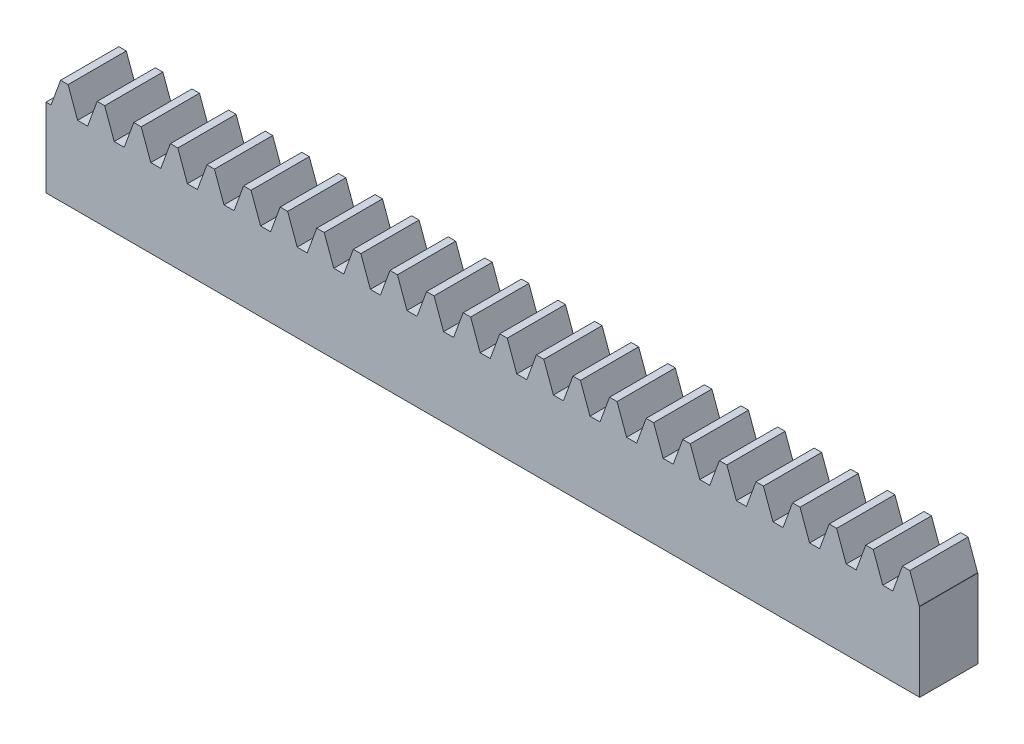
from build123d import *

# Parameters (mm, degrees)
BLANKSKE_W                      = 150
BLANKSKE_H                      = 12
BLANK_DEPTH                     = 5
TOOTHCUTSIM_DEPTH               = 151.562279473
TEETHCUTS_COUNT                 = 25
TEETHCUTS_PITCH                 = 6.2831853
SKETCH1_W                       = 150
SKETCH1_H                       = 6
BOSS_EXTRUDE1_DEPTH             = 10
MIRROR1_COPY_1_DEPTH            = 151.562279473
MIRROR1_COPY_2_DEPTH            = 151.562279473
MIRROR1_COPY_3_DEPTH            = 151.562279473
MIRROR1_COPY_4_DEPTH            = 151.562279473
MIRROR1_COPY_5_DEPTH            = 151.562279473
MIRROR1_COPY_6_DEPTH            = 151.562279473
MIRROR1_COPY_7_DEPTH            = 151.562279473
MIRROR1_COPY_8_DEPTH            = 151.562279473
MIRROR1_COPY_9_DEPTH            = 151.562279473
MIRROR1_COPY_10_DEPTH           = 151.562279473
MIRROR1_COPY_11_DEPTH           = 151.562279473
MIRROR1_COPY_12_DEPTH           = 151.562279473
MIRROR1_COPY_13_DEPTH           = 151.562279473
MIRROR1_COPY_14_DEPTH           = 151.562279473
MIRROR1_COPY_15_DEPTH           = 151.562279473
MIRROR1_COPY_16_DEPTH           = 151.562279473
MIRROR1_COPY_17_DEPTH           = 151.562279473
MIRROR1_COPY_18_DEPTH           = 151.562279473
MIRROR1_COPY_19_DEPTH           = 151.562279473
MIRROR1_COPY_20_DEPTH           = 151.562279473
MIRROR1_COPY_21_DEPTH           = 151.562279473
MIRROR1_COPY_22_DEPTH           = 151.562279473
MIRROR1_COPY_23_DEPTH           = 151.562279473
MIRROR1_COPY_24_DEPTH           = 151.562279473
MIRROR1_COPY_25_DEPTH           = 151.562279473
F_4_0MM_DOWEL_HOLE1_D           = 4
F_4_0MM_DOWEL_HOLE1_DEPTH       = 3
F_4_0MM_DOWEL_HOLE1_CSINK_D     = 4.05
F_4_0MM_DOWEL_HOLE1_CSINK_ANGLE = 90
F_4_0MM_DOWEL_HOLE1_TIP         = 1.201721238
SKETCH7_W                       = 12
SKETCH7_H                       = 6
CUT_EXTRUDE1_DEPTH              = 9.2
FILLET2_R                       = 5
FILLET3_R                       = 5


with BuildPart() as part:
    # BlankSke → Blank (new body)
    with BuildSketch(Plane.XY):
        with Locations((75, 6)):
            Rectangle(BLANKSKE_W, BLANKSKE_H)
    blank = extrude(amount=-BLANK_DEPTH)

    # TooCutSkeSim → ToothCutSim (cut, through all)
    with BuildSketch(Plane.XY):
        Polygon((0.861870739, 7.5), (-0.861870739, 7.5), (-2.508981637, 12.0254), (2.508981637, 12.0254), align=None)
    toothcutsim = extrude(amount=-TOOTHCUTSIM_DEPTH, mode=Mode.SUBTRACT)

    # TeethCuts: ToothCutSim ×25
    with Locations(*[(i * TEETHCUTS_PITCH, 0, 0) for i in range(1, TEETHCUTS_COUNT)]):
        add(toothcutsim, mode=Mode.SUBTRACT)

    # Sketch1 → Boss-Extrude1 (add)
    with BuildSketch(Plane(origin=(0, 0, -5), x_dir=(-1, 0, 0), z_dir=(0, 0, -1))):
        with Locations((-75, -3)):
            Rectangle(SKETCH1_W, SKETCH1_H)
    extrude(amount=-BOSS_EXTRUDE1_DEPTH)

    # Mirror1: Blank across plane
    add(blank.mirror(Plane.XY))

    # Mirror1 copy 1 sketch → Mirror1 copy 1 (cut, through all)
    with BuildSketch(Plane(origin=(6.2831853, 0, 0), x_dir=(1, 0, 0), z_dir=(0, 0, -1))):
        Polygon((0.861870739, -7.5), (-0.861870739, -7.5), (-2.508981637, -12.0254), (2.508981637, -12.0254), align=None)
    extrude(amount=-MIRROR1_COPY_1_DEPTH, mode=Mode.SUBTRACT)

    # Mirror1 copy 2 sketch → Mirror1 copy 2 (cut, through all)
    with BuildSketch(Plane(origin=(12.5663706, 0, 0), x_dir=(1, 0, 0), z_dir=(0, 0, -1))):
        Polygon((0.861870739, -7.5), (-0.861870739, -7.5), (-2.508981637, -12.0254), (2.508981637, -12.0254), align=None)
    extrude(amount=-MIRROR1_COPY_2_DEPTH, mode=Mode.SUBTRACT)

    # Mirror1 copy 3 sketch → Mirror1 copy 3 (cut, through all)
    with BuildSketch(Plane(origin=(18.8495559, 0, 0), x_dir=(1, 0, 0), z_dir=(0, 0, -1))):
        Polygon((0.861870739, -7.5), (-0.861870739, -7.5), (-2.508981637, -12.0254), (2.508981637, -12.0254), align=None)
    extrude(amount=-MIRROR1_COPY_3_DEPTH, mode=Mode.SUBTRACT)

    # Mirror1 copy 4 sketch → Mirror1 copy 4 (cut, through all)
    with BuildSketch(Plane(origin=(25.1327412, 0, 0), x_dir=(1, 0, 0), z_dir=(0, 0, -1))):
        Polygon((0.861870739, -7.5), (-0.861870739, -7.5), (-2.508981637, -12.0254), (2.508981637, -12.0254), align=None)
    extrude(amount=-MIRROR1_COPY_4_DEPTH, mode=Mode.SUBTRACT)

    # Mirror1 copy 5 sketch → Mirror1 copy 5 (cut, through all)
    with BuildSketch(Plane(origin=(31.4159265, 0, 0), x_dir=(1, 0, 0), z_dir=(0, 0, -1))):
        Polygon((0.861870739, -7.5), (-0.861870739, -7.5), (-2.508981637, -12.0254), (2.508981637, -12.0254), align=None)
    extrude(amount=-MIRROR1_COPY_5_DEPTH, mode=Mode.SUBTRACT)

    # Mirror1 copy 6 sketch → Mirror1 copy 6 (cut, through all)
    with BuildSketch(Plane(origin=(37.6991118, 0, 0), x_dir=(1, 0, 0), z_dir=(0, 0, -1))):
        Polygon((0.861870739, -7.5), (-0.861870739, -7.5), (-2.508981637, -12.0254), (2.508981637, -12.0254), align=None)
    extrude(amount=-MIRROR1_COPY_6_DEPTH, mode=Mode.SUBTRACT)

    # Mirror1 copy 7 sketch → Mirror1 copy 7 (cut, through all)
    with BuildSketch(Plane(origin=(43.9822971, 0, 0), x_dir=(1, 0, 0), z_dir=(0, 0, -1))):
        Polygon((0.861870739, -7.5), (-0.861870739, -7.5), (-2.508981637, -12.0254), (2.508981637, -12.0254), align=None)
    extrude(amount=-MIRROR1_COPY_7_DEPTH, mode=Mode.SUBTRACT)

    # Mirror1 copy 8 sketch → Mirror1 copy 8 (cut, through all)
    with BuildSketch(Plane(origin=(50.2654824, 0, 0), x_dir=(1, 0, 0), z_dir=(0, 0, -1))):
        Polygon((0.861870739, -7.5), (-0.861870739, -7.5), (-2.508981637, -12.0254), (2.508981637, -12.0254), align=None)
    extrude(amount=-MIRROR1_COPY_8_DEPTH, mode=Mode.SUBTRACT)

    # Mirror1 copy 9 sketch → Mirror1 copy 9 (cut, through all)
    with BuildSketch(Plane(origin=(56.5486677, 0, 0), x_dir=(1, 0, 0), z_dir=(0, 0, -1))):
        Polygon((0.861870739, -7.5), (-0.861870739, -7.5), (-2.508981637, -12.0254), (2.508981637, -12.0254), align=None)
    extrude(amount=-MIRROR1_COPY_9_DEPTH, mode=Mode.SUBTRACT)

    # Mirror1 copy 10 sketch → Mirror1 copy 10 (cut, through all)
    with BuildSketch(Plane(origin=(62.831853, 0, 0), x_dir=(1, 0, 0), z_dir=(0, 0, -1))):
        Polygon((0.861870739, -7.5), (-0.861870739, -7.5), (-2.508981637, -12.0254), (2.508981637, -12.0254), align=None)
    extrude(amount=-MIRROR1_COPY_10_DEPTH, mode=Mode.SUBTRACT)

    # Mirror1 copy 11 sketch → Mirror1 copy 11 (cut, through all)
    with BuildSketch(Plane(origin=(69.1150383, 0, 0), x_dir=(1, 0, 0), z_dir=(0, 0, -1))):
        Polygon((0.861870739, -7.5), (-0.861870739, -7.5), (-2.508981637, -12.0254), (2.508981637, -12.0254), align=None)
    extrude(amount=-MIRROR1_COPY_11_DEPTH, mode=Mode.SUBTRACT)

    # Mirror1 copy 12 sketch → Mirror1 copy 12 (cut, through all)
    with BuildSketch(Plane(origin=(75.3982236, 0, 0), x_dir=(1, 0, 0), z_dir=(0, 0, -1))):
        Polygon((0.861870739, -7.5), (-0.861870739, -7.5), (-2.508981637, -12.0254), (2.508981637, -12.0254), align=None)
    extrude(amount=-MIRROR1_COPY_12_DEPTH, mode=Mode.SUBTRACT)

    # Mirror1 copy 13 sketch → Mirror1 copy 13 (cut, through all)
    with BuildSketch(Plane(origin=(81.6814089, 0, 0), x_dir=(1, 0, 0), z_dir=(0, 0, -1))):
        Polygon((0.861870739, -7.5), (-0.861870739, -7.5), (-2.508981637, -12.0254), (2.508981637, -12.0254), align=None)
    extrude(amount=-MIRROR1_COPY_13_DEPTH, mode=Mode.SUBTRACT)

    # Mirror1 copy 14 sketch → Mirror1 copy 14 (cut, through all)
    with BuildSketch(Plane(origin=(87.9645942, 0, 0), x_dir=(1, 0, 0), z_dir=(0, 0, -1))):
        Polygon((0.861870739, -7.5), (-0.861870739, -7.5), (-2.508981637, -12.0254), (2.508981637, -12.0254), align=None)
    extrude(amount=-MIRROR1_COPY_14_DEPTH, mode=Mode.SUBTRACT)

    # Mirror1 copy 15 sketch → Mirror1 copy 15 (cut, through all)
    with BuildSketch(Plane(origin=(94.2477795, 0, 0), x_dir=(1, 0, 0), z_dir=(0, 0, -1))):
        Polygon((0.861870739, -7.5), (-0.861870739, -7.5), (-2.508981637, -12.0254), (2.508981637, -12.0254), align=None)
    extrude(amount=-MIRROR1_COPY_15_DEPTH, mode=Mode.SUBTRACT)

    # Mirror1 copy 16 sketch → Mirror1 copy 16 (cut, through all)
    with BuildSketch(Plane(origin=(100.5309648, 0, 0), x_dir=(1, 0, 0), z_dir=(0, 0, -1))):
        Polygon((0.861870739, -7.5), (-0.861870739, -7.5), (-2.508981637, -12.0254), (2.508981637, -12.0254), align=None)
    extrude(amount=-MIRROR1_COPY_16_DEPTH, mode=Mode.SUBTRACT)

    # Mirror1 copy 17 sketch → Mirror1 copy 17 (cut, through all)
    with BuildSketch(Plane(origin=(106.8141501, 0, 0), x_dir=(1, 0, 0), z_dir=(0, 0, -1))):
        Polygon((0.861870739, -7.5), (-0.861870739, -7.5), (-2.508981637, -12.0254), (2.508981637, -12.0254), align=None)
    extrude(amount=-MIRROR1_COPY_17_DEPTH, mode=Mode.SUBTRACT)

    # Mirror1 copy 18 sketch → Mirror1 copy 18 (cut, through all)
    with BuildSketch(Plane(origin=(113.0973354, 0, 0), x_dir=(1, 0, 0), z_dir=(0, 0, -1))):
        Polygon((0.861870739, -7.5), (-0.861870739, -7.5), (-2.508981637, -12.0254), (2.508981637, -12.0254), align=None)
    extrude(amount=-MIRROR1_COPY_18_DEPTH, mode=Mode.SUBTRACT)

    # Mirror1 copy 19 sketch → Mirror1 copy 19 (cut, through all)
    with BuildSketch(Plane(origin=(119.3805207, 0, 0), x_dir=(1, 0, 0), z_dir=(0, 0, -1))):
        Polygon((0.861870739, -7.5), (-0.861870739, -7.5), (-2.508981637, -12.0254), (2.508981637, -12.0254), align=None)
    extrude(amount=-MIRROR1_COPY_19_DEPTH, mode=Mode.SUBTRACT)

    # Mirror1 copy 20 sketch → Mirror1 copy 20 (cut, through all)
    with BuildSketch(Plane(origin=(125.663706, 0, 0), x_dir=(1, 0, 0), z_dir=(0, 0, -1))):
        Polygon((0.861870739, -7.5), (-0.861870739, -7.5), (-2.508981637, -12.0254), (2.508981637, -12.0254), align=None)
    extrude(amount=-MIRROR1_COPY_20_DEPTH, mode=Mode.SUBTRACT)

    # Mirror1 copy 21 sketch → Mirror1 copy 21 (cut, through all)
    with BuildSketch(Plane(origin=(131.9468913, 0, 0), x_dir=(1, 0, 0), z_dir=(0, 0, -1))):
        Polygon((0.861870739, -7.5), (-0.861870739, -7.5), (-2.508981637, -12.0254), (2.508981637, -12.0254), align=None)
    extrude(amount=-MIRROR1_COPY_21_DEPTH, mode=Mode.SUBTRACT)

    # Mirror1 copy 22 sketch → Mirror1 copy 22 (cut, through all)
    with BuildSketch(Plane(origin=(138.2300766, 0, 0), x_dir=(1, 0, 0), z_dir=(0, 0, -1))):
        Polygon((0.861870739, -7.5), (-0.861870739, -7.5), (-2.508981637, -12.0254), (2.508981637, -12.0254), align=None)
    extrude(amount=-MIRROR1_COPY_22_DEPTH, mode=Mode.SUBTRACT)

    # Mirror1 copy 23 sketch → Mirror1 copy 23 (cut, through all)
    with BuildSketch(Plane(origin=(144.5132619, 0, 0), x_dir=(1, 0, 0), z_dir=(0, 0, -1))):
        Polygon((0.861870739, -7.5), (-0.861870739, -7.5), (-2.508981637, -12.0254), (2.508981637, -12.0254), align=None)
    extrude(amount=-MIRROR1_COPY_23_DEPTH, mode=Mode.SUBTRACT)

    # Mirror1 copy 24 sketch → Mirror1 copy 24 (cut, through all)
    with BuildSketch(Plane(origin=(150.7964472, 0, 0), x_dir=(1, 0, 0), z_dir=(0, 0, -1))):
        Polygon((0.861870739, -7.5), (-0.861870739, -7.5), (-2.508981637, -12.0254), (2.508981637, -12.0254), align=None)
    extrude(amount=-MIRROR1_COPY_24_DEPTH, mode=Mode.SUBTRACT)

    # Mirror1 copy 25 sketch → Mirror1 copy 25 (cut, through all)
    with BuildSketch(Plane(origin=(0, 0, 0), x_dir=(1, 0, 0), z_dir=(0, 0, -1))):
        Polygon((0.861870739, -7.5), (-0.861870739, -7.5), (-2.508981637, -12.0254), (2.508981637, -12.0254), align=None)
    extrude(amount=-MIRROR1_COPY_25_DEPTH, mode=Mode.SUBTRACT)

    # Ø4.0mm Dowel Hole1
    with Locations(Plane(origin=(0, -6, 0), x_dir=(-1, 0, 0), z_dir=(0, -1, 0))):
        with Locations((-50, 0), (-100, 0)):
            CounterSinkHole(F_4_0MM_DOWEL_HOLE1_D / 2, F_4_0MM_DOWEL_HOLE1_CSINK_D / 2, depth=F_4_0MM_DOWEL_HOLE1_DEPTH, counter_sink_angle=F_4_0MM_DOWEL_HOLE1_CSINK_ANGLE)
            with Locations((0, 0, -(F_4_0MM_DOWEL_HOLE1_DEPTH + F_4_0MM_DOWEL_HOLE1_TIP / 2))):  # 118° drill point
                Cone(0, F_4_0MM_DOWEL_HOLE1_D / 2, F_4_0MM_DOWEL_HOLE1_TIP, mode=Mode.SUBTRACT)

    # Sketch7 → Cut-Extrude1 (cut)
    with BuildSketch(Plane(origin=(0, 0, -5), x_dir=(-1, 0, 0), z_dir=(0, 0, -1))):
        Polygon((-106, -3), (-100, -3), (-94, -3), (-94, 3), (-106, 3), align=None)
        with Locations((-50, 0)):
            Rectangle(SKETCH7_W, SKETCH7_H)
    extrude(amount=-CUT_EXTRUDE1_DEPTH, mode=Mode.SUBTRACT)

    # Fillet2
    fillet2_edges = [part.edges().sort_by_distance(p)[0] for p in [
        (106, 3, -0.4),
        (94, 3, -0.4),
    ]]
    fillet(fillet2_edges, radius=FILLET2_R)

    # Fillet3
    fillet3_edges = [part.edges().sort_by_distance(p)[0] for p in [
        (56, 3, -0.4),
        (44, 3, -0.4),
    ]]
    fillet(fillet3_edges, radius=FILLET3_R)


solid = part.part
